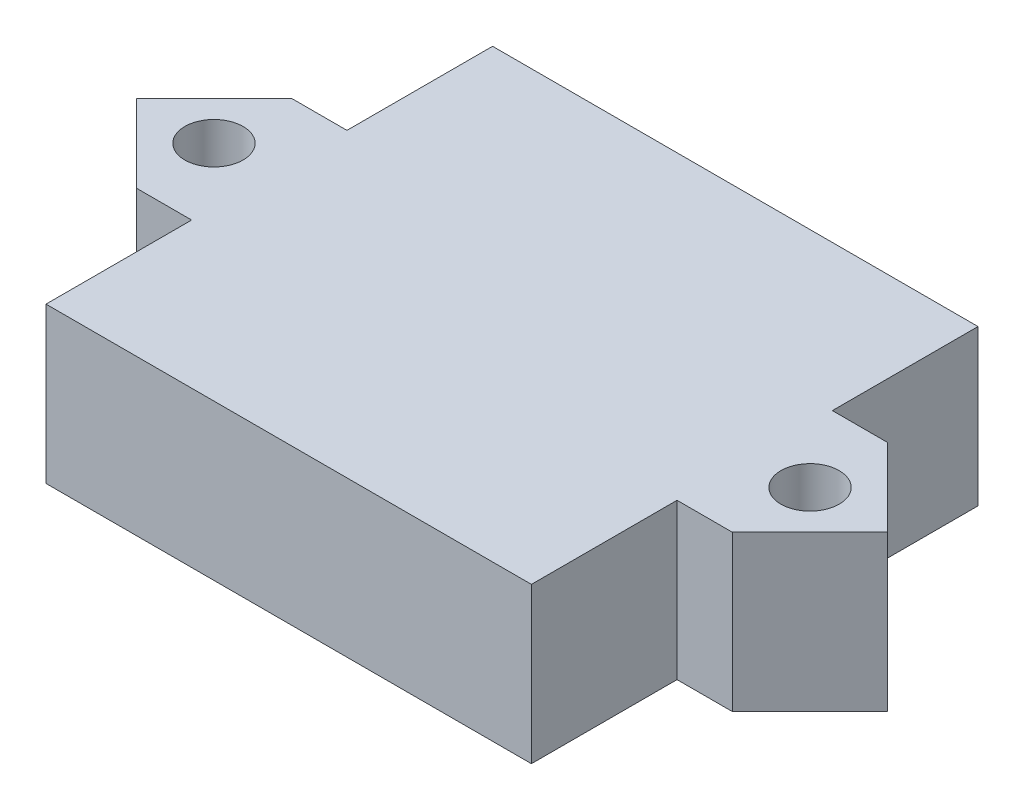
from build123d import *

# Parameters (mm, degrees)
SKETCH_1_R           = 1.5
F_8MM_DEPTH          = 8
MOVE_FACE_25_23_BY   = 1
MOVE_FACE_25_23_2_BY = 1


with BuildPart() as part:
    # 草图1 → 外壳模块组合包络_厚度暂估8mm (new body)
    with BuildSketch(Plane(origin=(0, 0, 0), x_dir=(1, 0, 0), z_dir=(0, 1, 0))):
        Polygon((-19.35, 0), (-15.35, -4), (-12.5, -4), (-12.5, -12.5), (12.5, -12.5), (12.5, -4), (15.35, -4), (19.35, 0), (15.35, 4), (12.5, 4), (12.5, 12.5), (-12.5, 12.5), (-12.5, 4), (-15.35, 4), align=None)
        with Locations(Location((-15.35, 0, 0), (0, 0, 270))):
            Circle(SKETCH_1_R, mode=Mode.SUBTRACT)
        with Locations(Location((15.35, 0, 0), (0, 0, 270))):
            Circle(SKETCH_1_R, mode=Mode.SUBTRACT)
    extrude(amount=F_8MM_DEPTH)

    # Move Face 25_23: a face moved inward by 1.0
    extrude(part.faces().sort_by_distance((0, 4, -12.5))[0], amount=MOVE_FACE_25_23_BY, dir=(0, 0, 1), mode=Mode.SUBTRACT)

    # Move Face 25_23 2: a face moved inward by 1.0
    extrude(part.faces().sort_by_distance((0, 4, 12.5))[0], amount=MOVE_FACE_25_23_2_BY, dir=(0, 0, -1), mode=Mode.SUBTRACT)


solid = part.part
